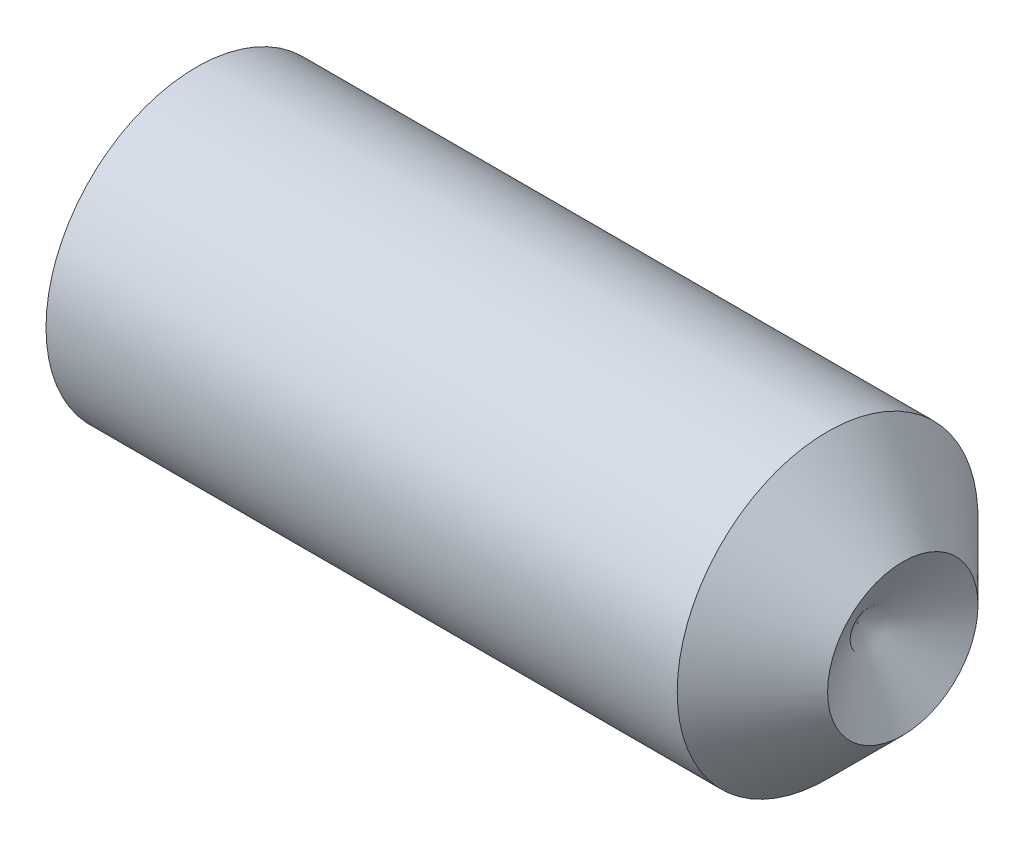
from build123d import *

# Parameters (mm, degrees)
HEX_2_DEPTH = 2.7


with BuildPart() as part:
    # BodySke → BaseBody (revolve)
    with BuildSketch(Plane.XY, mode=Mode.PRIVATE) as basebody_sk:
        Polygon((0, 0), (0, 2.055), (0.25692087, 2.5), (10.75, 2.5), (12, 1.25), (11.248924226, 0), align=None)
    revolve(basebody_sk.sketch.rotate(Axis((-12.7, 0, 0), (1, 0, 0)), 90), axis=Axis((-12.7, 0, 0), (1, 0, 0)))

    # Sketch2 → Hex 2 (cut)
    with BuildSketch(Plane.ZY):
        Polygon((0.721687836, 1.25), (-0.721687836, 1.25), (-1.443375673, 0), (-0.721687836, -1.25), (0.721687836, -1.25), (1.443375673, 0), align=None)
    extrude(amount=-HEX_2_DEPTH, mode=Mode.SUBTRACT)


solid = part.part
